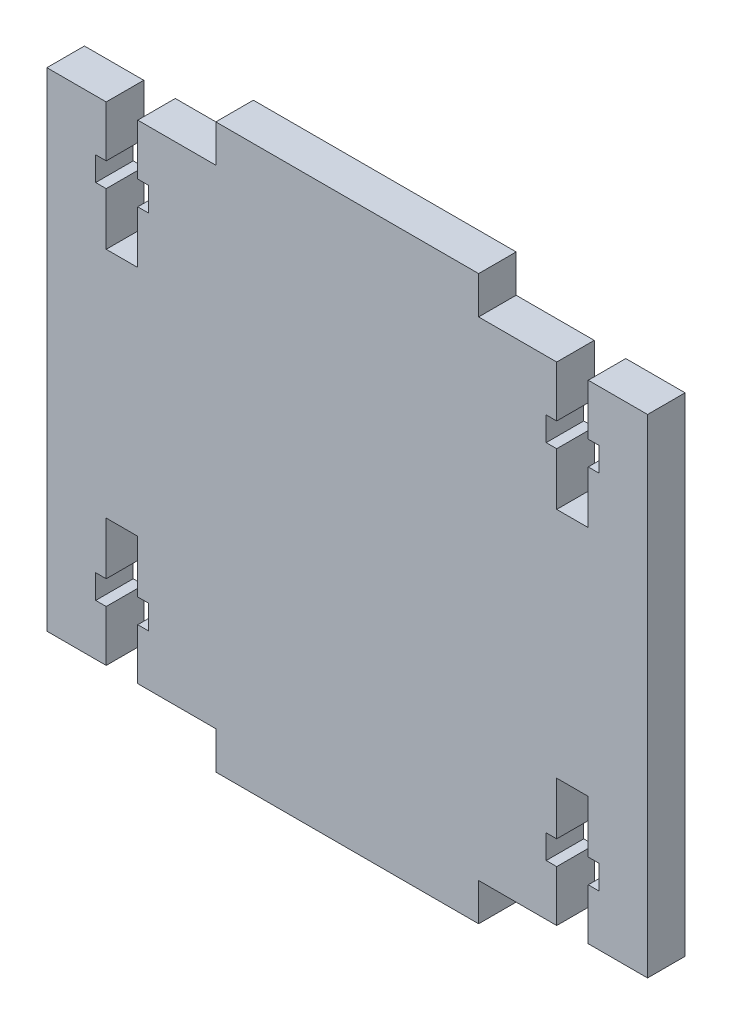
from build123d import *

# Parameters (mm, degrees)
BOSS_EXTRUDE1_DEPTH = 5


with BuildPart() as part:
    # Sketch1 → Boss-Extrude1 (new body)
    with BuildSketch(Plane.XY):
        Polygon((-24.134366274, 26.630625459), (-32.034366274, 26.630625459), (-32.034366274, -38.369374541), (-24.134366274, -38.369374541), (-24.134366274, -31.569374541), (-25.534366274, -31.569374541), (-25.534366274, -28.369374541), (-24.134366274, -28.369374541), (-24.134366274, -21.369374541), (-19.934366274, -21.369374541), (-19.934366274, -28.369374541), (-18.534366274, -28.369374541), (-18.534366274, -31.569374541), (-19.934366274, -31.569374541), (-19.934366274, -38.369374541), (-9.534366274, -38.369374541), (-9.534366274, -43.369374541), (25.465633726, -43.369374541), (25.465633726, -38.369374541), (35.865633726, -38.369374541), (35.865633726, -31.569374541), (34.465633726, -31.569374541), (34.465633726, -28.369374541), (35.865633726, -28.369374541), (35.865633726, -21.369374541), (40.065633726, -21.369374541), (40.065633726, -28.369374541), (41.465633726, -28.369374541), (41.465633726, -31.569374541), (40.065633726, -31.569374541), (40.065633726, -38.369374541), (47.965633726, -38.369374541), (47.965633726, 26.630625459), (40.065633726, 26.630625459), (40.065633726, 19.830625459), (41.465633726, 19.830625459), (41.465633726, 16.630625459), (40.065633726, 16.630625459), (40.065633726, 9.630625459), (35.865633726, 9.630625459), (35.865633726, 16.630625459), (34.465633726, 16.630625459), (34.465633726, 19.830625459), (35.865633726, 19.830625459), (35.865633726, 26.630625459), (25.465633726, 26.630625459), (25.465633726, 31.630625459), (-9.534366274, 31.630625459), (-9.534366274, 26.630625459), (-19.934366274, 26.630625459), (-19.934366274, 19.830625459), (-18.534366274, 19.830625459), (-18.534366274, 16.630625459), (-19.934366274, 16.630625459), (-19.934366274, 9.630625459), (-24.134366274, 9.630625459), (-24.134366274, 16.630625459), (-25.534366274, 16.630625459), (-25.534366274, 19.830625459), (-24.134366274, 19.830625459), align=None)
    extrude(amount=BOSS_EXTRUDE1_DEPTH)


solid = part.part
